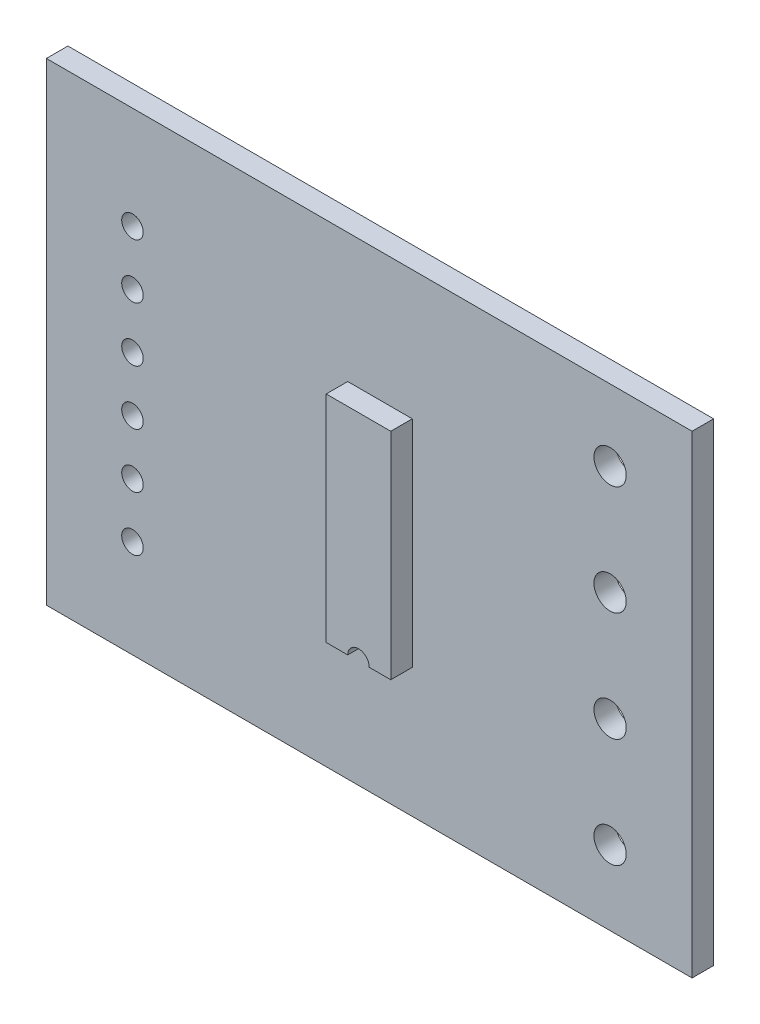
from build123d import *

# Parameters (mm, degrees)
SKETCH_1_W          = 30
SKETCH_1_H          = 22
EXTRUDE_1_DEPTH     = 1
SKETCH_2_R          = 0.5
SKETCH_2_R_2        = 0.75
CUT_EXTRUDE_1_DEPTH = 38.215588132
SKETCH_3_W          = 3
SKETCH_3_H          = 10
EXTRUDE_2_DEPTH     = 1
SKETCH_4_R          = 0.5
CUT_EXTRUDE_2_DEPTH = 1


with BuildPart() as part:
    # ｽｹｯﾁ1 → ﾎﾞｽ - 押し出し1 (new body)
    with BuildSketch(Plane.XY):
        with Locations((15, 11)):
            Rectangle(SKETCH_1_W, SKETCH_1_H)
    extrude(amount=EXTRUDE_1_DEPTH)

    # ｽｹｯﾁ2 → ｶｯﾄ - 押し出し1 (cut, through all)
    with BuildSketch(Plane.XY.offset(1)):
        with Locations((4, 17.25)):
            Circle(SKETCH_2_R)
        with Locations((4, 14.71)):
            Circle(SKETCH_2_R)
        with Locations((4, 12.17)):
            Circle(SKETCH_2_R)
        with Locations((4, 9.63)):
            Circle(SKETCH_2_R)
        with Locations((4, 7.09)):
            Circle(SKETCH_2_R)
        with Locations((4, 4.55)):
            Circle(SKETCH_2_R)
        with Locations((26.19, 18.69)):
            Circle(SKETCH_2_R_2)
        with Locations((26.19, 13.61)):
            Circle(SKETCH_2_R_2)
        with Locations((26.19, 8.53)):
            Circle(SKETCH_2_R_2)
        with Locations((26.19, 3.45)):
            Circle(SKETCH_2_R_2)
    extrude(amount=-CUT_EXTRUDE_1_DEPTH, mode=Mode.SUBTRACT)

    # ｽｹｯﾁ3 → ﾎﾞｽ - 押し出し2 (add)
    with BuildSketch(Plane.XY.offset(1)):
        with Locations((15.5, 11)):
            Rectangle(SKETCH_3_W, SKETCH_3_H)
    extrude(amount=EXTRUDE_2_DEPTH)

    # ｽｹｯﾁ4 → ｶｯﾄ - 押し出し2 (cut)
    with BuildSketch(Plane.XY.offset(2)):
        with Locations((15.5, 6)):
            Circle(SKETCH_4_R)
    extrude(amount=-CUT_EXTRUDE_2_DEPTH, mode=Mode.SUBTRACT)


solid = part.part
